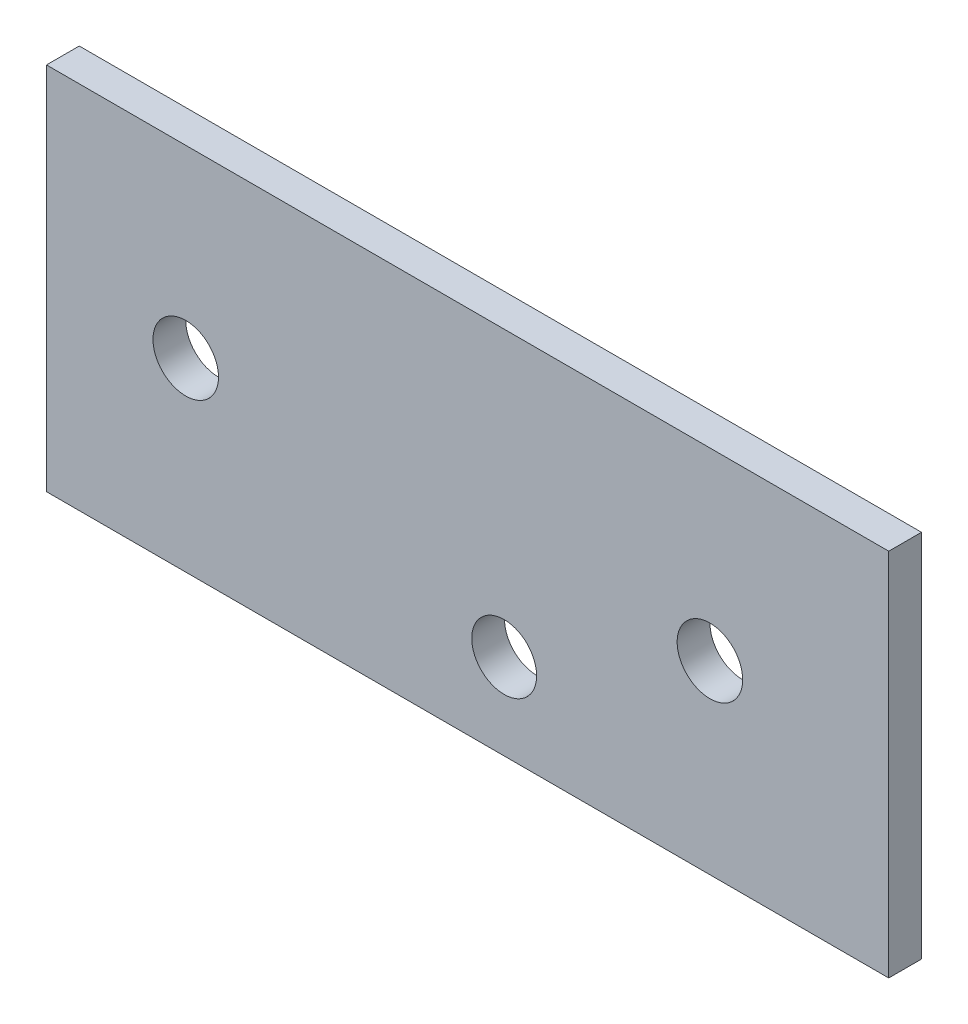
from build123d import *

# Parameters (mm, degrees)
SKETCH1_W           = 81.624716177
SKETCH1_H           = 35.822200768
SKETCH1_R           = 3.175
SKETCH1_R_2         = 3.143617789
BOSS_EXTRUDE1_DEPTH = 3.175


with BuildPart() as part:
    # Sketch1 → Boss-Extrude1 (new body)
    with BuildSketch(Plane.XY):
        with Locations((1.918230209, -176.935128554)):
            Rectangle(SKETCH1_W, SKETCH1_H)
        with Locations((-25.4, -176.892857143)):
            Circle(SKETCH1_R, mode=Mode.SUBTRACT)
        with Locations((25.4, -176.892857143)):
            Circle(SKETCH1_R, mode=Mode.SUBTRACT)
        with Locations((5.461, -186.53968721)):
            Circle(SKETCH1_R_2, mode=Mode.SUBTRACT)
    extrude(amount=BOSS_EXTRUDE1_DEPTH)


solid = part.part
